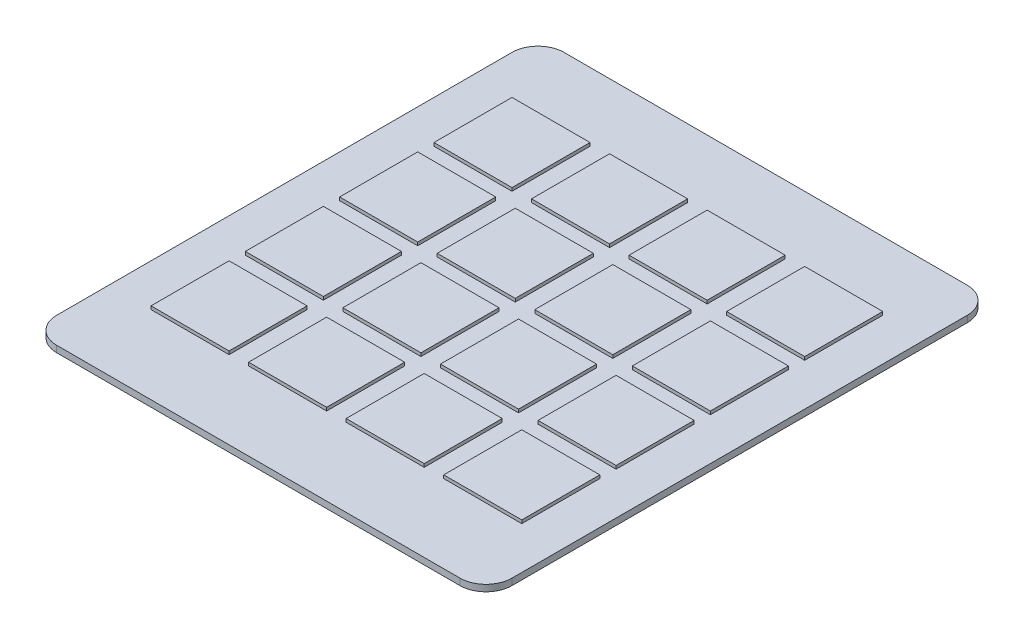
from build123d import *

# Parameters (mm, degrees)
SKIZZE2_W                       = 70
SKIZZE2_H                       = 78
AUFSATZ_LINEAR_AUSTRAGEN1_DEPTH = 1
SKIZZE3_W                       = 12
SKIZZE3_H                       = 12
AUFSATZ_LINEAR_AUSTRAGEN2_DEPTH = 0.5
LINEARES_MUSTER1_COUNT          = 4
LINEARES_MUSTER1_PITCH          = 14.5
LINEARES_MUSTER1_2_COUNT        = 4
LINEARES_MUSTER1_2_PITCH        = 15
VERRUNDUNG1_R                   = 4


with BuildPart() as part:
    # Skizze2 → Aufsatz-Linear austragen1 (new body)
    with BuildSketch(Plane(origin=(0, 1, 0), x_dir=(1, 0, 0), z_dir=(0, 1, 0))):
        with Locations((35, 39)):
            Rectangle(SKIZZE2_W, SKIZZE2_H)
    extrude(amount=-AUFSATZ_LINEAR_AUSTRAGEN1_DEPTH)

    # Verrundung1
    verrundung1_edges = [part.edges().sort_by_distance(p)[0] for p in [
        (0, 0.5, -78),
        (70, 0.5, -78),
        (70, 0.5, 0),
        (0, 0.5, 0),
    ]]
    fillet(verrundung1_edges, radius=VERRUNDUNG1_R)


with BuildPart() as body_2:
    # Skizze3 → Aufsatz-Linear austragen2 (new body)
    with BuildSketch(Plane(origin=(0, 1, 0), x_dir=(1, 0, 0), z_dir=(0, 1, 0))):
        with Locations((12.5, 18)):
            Rectangle(SKIZZE3_W, SKIZZE3_H)
    extrude(amount=AUFSATZ_LINEAR_AUSTRAGEN2_DEPTH)


with BuildPart() as lineares_muster1_1:
    # Lineares Muster1: pattern copy
    add(body_2.part.moved(Location(Vector(0, 0, -1) * (1 * LINEARES_MUSTER1_PITCH))))


with BuildPart() as lineares_muster1_2:
    # Lineares Muster1: pattern copy
    add(body_2.part.moved(Location(Vector(0, 0, -1) * (2 * LINEARES_MUSTER1_PITCH))))


with BuildPart() as lineares_muster1_3:
    # Lineares Muster1: pattern copy
    add(body_2.part.moved(Location(Vector(0, 0, -1) * (3 * LINEARES_MUSTER1_PITCH))))


with BuildPart() as lineares_muster1_2_1:
    # Lineares Muster1 2: pattern copy
    add(body_2.part.moved(Location(Vector(1, 0, 0) * (1 * LINEARES_MUSTER1_2_PITCH))))


with BuildPart() as lineares_muster1_2_2:
    # Lineares Muster1 2: pattern copy
    add(body_2.part.moved(Location(Vector(1, 0, 0) * (2 * LINEARES_MUSTER1_2_PITCH))))


with BuildPart() as lineares_muster1_2_3:
    # Lineares Muster1 2: pattern copy
    add(body_2.part.moved(Location(Vector(1, 0, 0) * (3 * LINEARES_MUSTER1_2_PITCH))))


with BuildPart() as lineares_muster1_2_4:
    # Lineares Muster1 2: pattern copy
    add(lineares_muster1_1.part.moved(Location(Vector(1, 0, 0) * (1 * LINEARES_MUSTER1_2_PITCH))))


with BuildPart() as lineares_muster1_2_5:
    # Lineares Muster1 2: pattern copy
    add(lineares_muster1_1.part.moved(Location(Vector(1, 0, 0) * (2 * LINEARES_MUSTER1_2_PITCH))))


with BuildPart() as lineares_muster1_2_6:
    # Lineares Muster1 2: pattern copy
    add(lineares_muster1_1.part.moved(Location(Vector(1, 0, 0) * (3 * LINEARES_MUSTER1_2_PITCH))))


with BuildPart() as lineares_muster1_2_7:
    # Lineares Muster1 2: pattern copy
    add(lineares_muster1_2.part.moved(Location(Vector(1, 0, 0) * (1 * LINEARES_MUSTER1_2_PITCH))))


with BuildPart() as lineares_muster1_2_8:
    # Lineares Muster1 2: pattern copy
    add(lineares_muster1_2.part.moved(Location(Vector(1, 0, 0) * (2 * LINEARES_MUSTER1_2_PITCH))))


with BuildPart() as lineares_muster1_2_9:
    # Lineares Muster1 2: pattern copy
    add(lineares_muster1_2.part.moved(Location(Vector(1, 0, 0) * (3 * LINEARES_MUSTER1_2_PITCH))))


with BuildPart() as lineares_muster1_2_10:
    # Lineares Muster1 2: pattern copy
    add(lineares_muster1_3.part.moved(Location(Vector(1, 0, 0) * (1 * LINEARES_MUSTER1_2_PITCH))))


with BuildPart() as lineares_muster1_2_11:
    # Lineares Muster1 2: pattern copy
    add(lineares_muster1_3.part.moved(Location(Vector(1, 0, 0) * (2 * LINEARES_MUSTER1_2_PITCH))))


with BuildPart() as lineares_muster1_2_12:
    # Lineares Muster1 2: pattern copy
    add(lineares_muster1_3.part.moved(Location(Vector(1, 0, 0) * (3 * LINEARES_MUSTER1_2_PITCH))))


solid = Compound([part.part, body_2.part, lineares_muster1_1.part, lineares_muster1_2.part, lineares_muster1_3.part, lineares_muster1_2_1.part, lineares_muster1_2_2.part, lineares_muster1_2_3.part, lineares_muster1_2_4.part, lineares_muster1_2_5.part, lineares_muster1_2_6.part, lineares_muster1_2_7.part, lineares_muster1_2_8.part, lineares_muster1_2_9.part, lineares_muster1_2_10.part, lineares_muster1_2_11.part, lineares_muster1_2_12.part])
